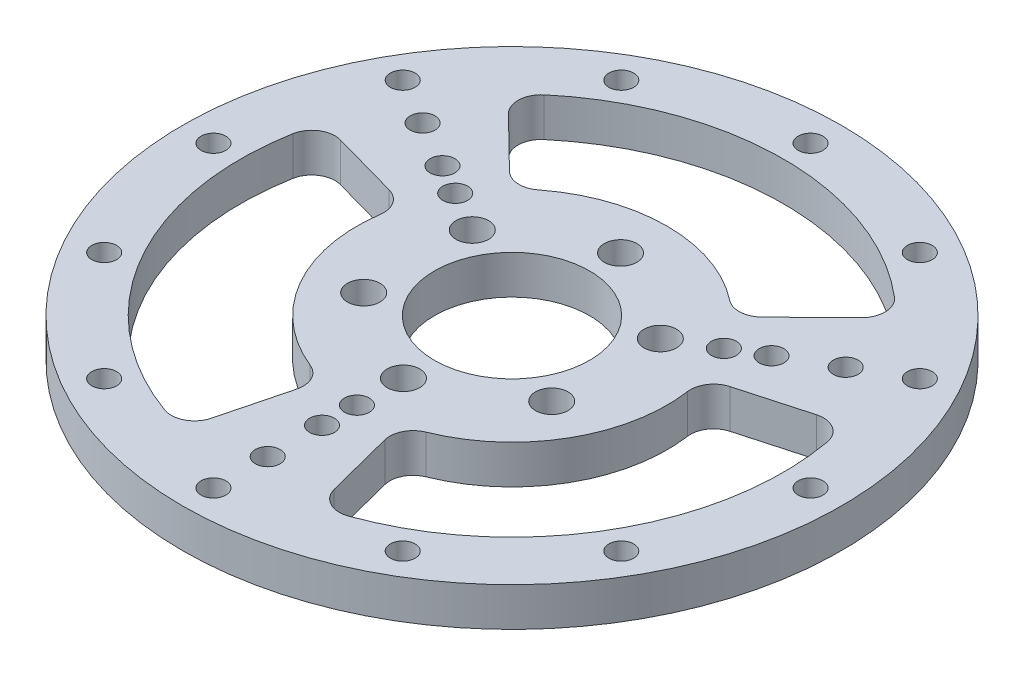
from build123d import *

# Parameters (mm, degrees)
SKETCH_1_R      = 42.5
SKETCH_1_R_2    = 10
SKETCH_1_R_3    = 2.1
SKETCH_1_R_4    = 1.6
EXTRUDE_1_DEPTH = 5
FILLET_1_R      = 3


with BuildPart() as part:
    # 草图1 → 凸台-拉伸1 (new body)
    with BuildSketch(Plane(origin=(0, 0, 0), x_dir=(1, 0, 0), z_dir=(0, 1, 0))):
        with Locations(Location((0, 0, 0), (0, 0, 270))):
            Circle(SKETCH_1_R)
        with Locations(Location((0, 0, 0), (0, 0, 270))):
            Circle(SKETCH_1_R_2, mode=Mode.SUBTRACT)
        with Locations(Location((0, 14, 0), (0, 0, 270))):
            Circle(SKETCH_1_R_3, mode=Mode.SUBTRACT)
        with Locations(Location((12.124355653, 7, 0), (0, 0, 270))):
            Circle(SKETCH_1_R_3, mode=Mode.SUBTRACT)
        with Locations(Location((12.124355653, -7, 0), (0, 0, 270))):
            Circle(SKETCH_1_R_3, mode=Mode.SUBTRACT)
        with Locations(Location((0, -14, 0), (0, 0, 270))):
            Circle(SKETCH_1_R_3, mode=Mode.SUBTRACT)
        with Locations(Location((-12.124355653, -7, 0), (0, 0, 270))):
            Circle(SKETCH_1_R_3, mode=Mode.SUBTRACT)
        with Locations(Location((-12.124355653, 7, 0), (0, 0, 270))):
            Circle(SKETCH_1_R_3, mode=Mode.SUBTRACT)
        with Locations(Location((0, 38.5, 0), (0, 0, 270))):
            Circle(SKETCH_1_R_4, mode=Mode.SUBTRACT)
        with Locations(Location((19.25, 33.341978046, 0), (0, 0, 270))):
            Circle(SKETCH_1_R_4, mode=Mode.SUBTRACT)
        with Locations(Location((33.341978046, 19.25, 0), (0, 0, 270))):
            Circle(SKETCH_1_R_4, mode=Mode.SUBTRACT)
        with Locations(Location((38.5, 0, 0), (0, 0, 270))):
            Circle(SKETCH_1_R_4, mode=Mode.SUBTRACT)
        with Locations(Location((33.341978046, -19.25, 0), (0, 0, 270))):
            Circle(SKETCH_1_R_4, mode=Mode.SUBTRACT)
        with Locations(Location((19.25, -33.341978046, 0), (0, 0, 270))):
            Circle(SKETCH_1_R_4, mode=Mode.SUBTRACT)
        with Locations(Location((0, -38.5, 0), (0, 0, 270))):
            Circle(SKETCH_1_R_4, mode=Mode.SUBTRACT)
        with Locations(Location((-19.25, -33.341978046, 0), (0, 0, 270))):
            Circle(SKETCH_1_R_4, mode=Mode.SUBTRACT)
        with Locations(Location((-33.341978046, -19.25, 0), (0, 0, 270))):
            Circle(SKETCH_1_R_4, mode=Mode.SUBTRACT)
        with Locations(Location((-38.5, 0, 0), (0, 0, 270))):
            Circle(SKETCH_1_R_4, mode=Mode.SUBTRACT)
        with Locations(Location((-33.341978046, 19.25, 0), (0, 0, 270))):
            Circle(SKETCH_1_R_4, mode=Mode.SUBTRACT)
        with Locations(Location((-19.25, 33.341978046, 0), (0, 0, 270))):
            Circle(SKETCH_1_R_4, mode=Mode.SUBTRACT)
        with Locations(Location((-27.279800219, 15.75, 0), (0, 0, 270))):
            Circle(SKETCH_1_R_4, mode=Mode.SUBTRACT)
        with Locations(Location((-21.217622393, 12.25, 0), (0, 0, 270))):
            Circle(SKETCH_1_R_4, mode=Mode.SUBTRACT)
        with Locations(Location((-17.320508076, 10, 0), (0, 0, 270))):
            Circle(SKETCH_1_R_4, mode=Mode.SUBTRACT)
        with Locations(Location((27.279800219, 15.75, 0), (0, 0, 270))):
            Circle(SKETCH_1_R_4, mode=Mode.SUBTRACT)
        with Locations(Location((21.217622393, 12.25, 0), (0, 0, 270))):
            Circle(SKETCH_1_R_4, mode=Mode.SUBTRACT)
        with Locations(Location((17.320508076, 10, 0), (0, 0, 270))):
            Circle(SKETCH_1_R_4, mode=Mode.SUBTRACT)
        with Locations(Location((0, -31.5, 0), (0, 0, 270))):
            Circle(SKETCH_1_R_4, mode=Mode.SUBTRACT)
        with Locations(Location((0, -24.5, 0), (0, 0, 270))):
            Circle(SKETCH_1_R_4, mode=Mode.SUBTRACT)
        with Locations(Location((0, -20, 0), (0, 0, 270))):
            Circle(SKETCH_1_R_4, mode=Mode.SUBTRACT)
        with BuildLine():
            Line((-25, 24.494897428), (-14.285714286, 13.997084244))
            ThreePointArc((-14.285714286, 13.997084244), (0, 20), (14.285714286, 13.997084244))
            Line((14.285714286, 13.997084244), (25, 24.494897428))
            ThreePointArc((25, 24.494897428), (0, 35), (-25, 24.494897428))
        make_face(mode=Mode.SUBTRACT)
        with BuildLine():
            Line((8.713203436, -33.898083809), (4.978973392, -19.370333605))
            ThreePointArc((4.978973392, -19.370333605), (17.320508076, -10), (19.264687677, 5.37324936))
            Line((19.264687677, 5.37324936), (33.713203436, 9.403186381))
            ThreePointArc((33.713203436, 9.403186381), (30.310889132, -17.5), (8.713203436, -33.898083809))
        make_face(mode=Mode.SUBTRACT)
        with BuildLine():
            Line((-33.713203436, 9.403186381), (-19.264687677, 5.37324936))
            ThreePointArc((-19.264687677, 5.37324936), (-17.320508076, -10), (-4.978973392, -19.370333605))
            Line((-4.978973392, -19.370333605), (-8.713203436, -33.898083809))
            ThreePointArc((-8.713203436, -33.898083809), (-30.310889132, -17.5), (-33.713203436, 9.403186381))
        make_face(mode=Mode.SUBTRACT)
    extrude(amount=EXTRUDE_1_DEPTH)

    # 圆角1
    fillet_1_edges = [part.edges().sort_by_distance(p)[0] for p in [
        (8.713203436, 2.5, 33.898083809),
        (33.713203436, 2.5, -9.403186381),
        (19.264687677, 2.5, -5.37324936),
        (4.978973392, 2.5, 19.370333605),
        (-33.713203436, 2.5, -9.403186381),
        (-8.713203436, 2.5, 33.898083809),
        (-4.978973392, 2.5, 19.370333605),
        (-19.264687677, 2.5, -5.37324936),
        (25, 2.5, -24.494897428),
        (-25, 2.5, -24.494897428),
        (-14.285714286, 2.5, -13.997084244),
        (14.285714286, 2.5, -13.997084244),
    ]]
    fillet(fillet_1_edges, radius=FILLET_1_R)


solid = part.part
